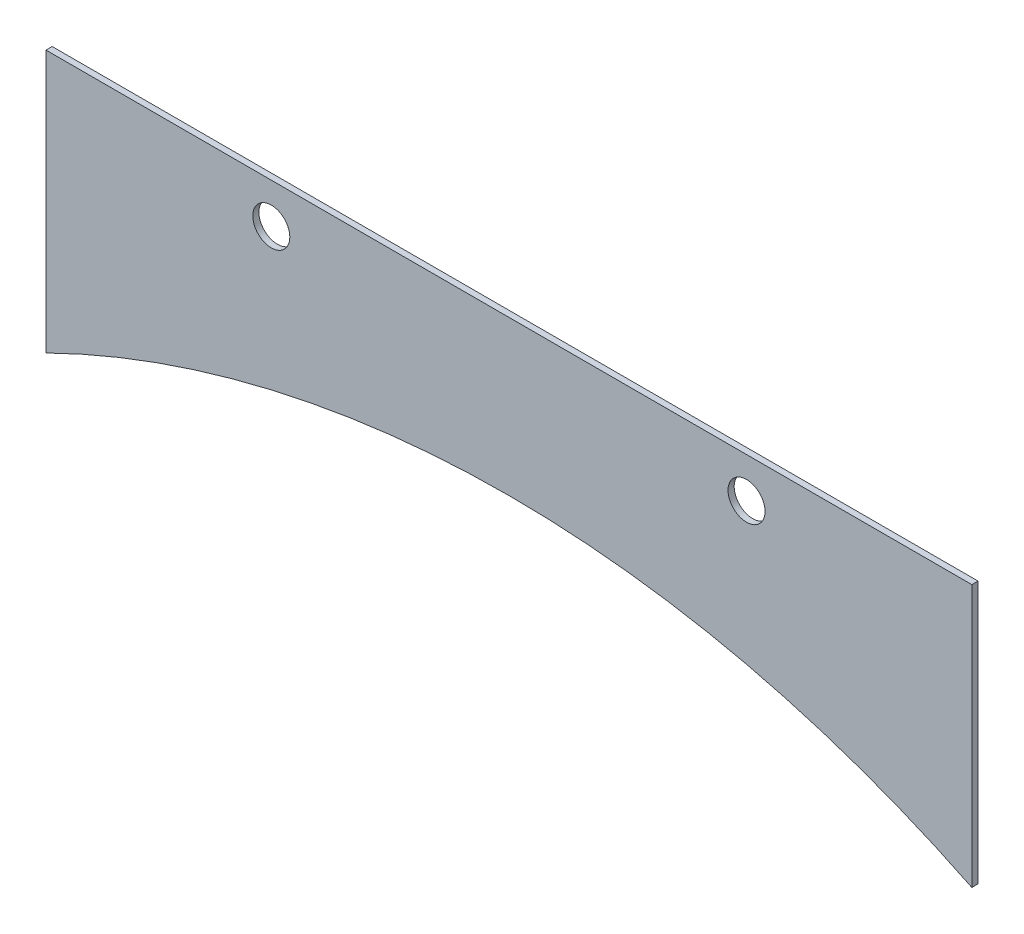
from build123d import *

# Parameters (mm, degrees)
SALIENTE_EXTRUIR1_DEPTH = 2
CROQUIS2_R              = 6
CORTAR_EXTRUIR1_DEPTH   = 173.420996401


with BuildPart() as part:
    # Croquis1 → Saliente-Extruir1 (new body)
    with BuildSketch(Plane.XY):
        with BuildLine():
            Line((-150, 0), (-150, 85))
            Line((-150, 85), (150, 85))
            Line((150, 85), (150, 0))
            ThreePointArc((150, 0), (0, 35), (-150, 0))
        make_face()
    extrude(amount=SALIENTE_EXTRUIR1_DEPTH)

    # Croquis2 → Cortar-Extruir1 (cut, through all)
    with BuildSketch(Plane.XY.offset(2)):
        with Locations((-77, 72)):
            Circle(CROQUIS2_R)
        with Locations((77, 72)):
            Circle(CROQUIS2_R)
    extrude(amount=-CORTAR_EXTRUIR1_DEPTH, mode=Mode.SUBTRACT)


solid = part.part
